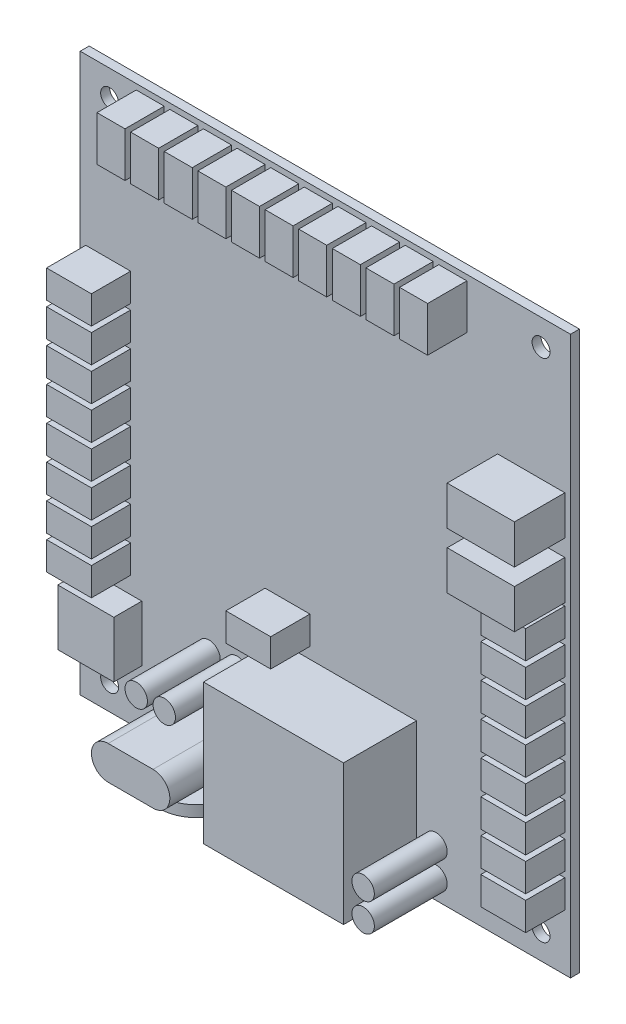
from build123d import *

# Parameters (mm, degrees)
SKETCH_1_W      = 87.5
SKETCH_1_H      = 99.5
SKETCH_1_R      = 1.6
EXTRUDE_1_DEPTH = 1.6
SKETCH_2_W      = 10
SKETCH_2_H      = 10
EXTRUDE_2_DEPTH = 5
SKETCH_3_W      = 25
SKETCH_3_H      = 25
EXTRUDE_3_DEPTH = 13
SKETCH_4_W      = 5
SKETCH_4_H      = 8
SKETCH_4_W_2    = 8
SKETCH_4_H_2    = 5
EXTRUDE_4_DEPTH = 7
SKETCH_5_W      = 12
SKETCH_5_H      = 7
EXTRUDE_5_DEPTH = 9
EXTRUDE_6_DEPTH = 18
SKETCH_7_R      = 2
EXTRUDE_7_DEPTH = 13
SKETCH_8_R      = 6.5
EXTRUDE_8_DEPTH = 2


with BuildPart() as part:
    # 草图1 → 凸台-拉伸1 (new body)
    with BuildSketch(Plane.XY):
        Rectangle(SKETCH_1_W, SKETCH_1_H)
        with Locations((-38.5, 45.15)):
            Circle(SKETCH_1_R, mode=Mode.SUBTRACT)
        with Locations((38.5, 45.15)):
            Circle(SKETCH_1_R, mode=Mode.SUBTRACT)
        with Locations((-38.5, -45.15)):
            Circle(SKETCH_1_R, mode=Mode.SUBTRACT)
        with Locations((38.5, -45.15)):
            Circle(SKETCH_1_R, mode=Mode.SUBTRACT)
    extrude(amount=EXTRUDE_1_DEPTH)

    # 草图2 → 凸台-拉伸2 (add)
    with BuildSketch(Plane.XY.offset(1.6)):
        with Locations((-37.75, -34.75)):
            Rectangle(SKETCH_2_W, SKETCH_2_H)
    extrude(amount=EXTRUDE_2_DEPTH)

    # 草图3 → 凸台-拉伸3 (add)
    with BuildSketch(Plane.XY.offset(1.6)):
        with Locations((3.75, -36.25)):
            Rectangle(SKETCH_3_W, SKETCH_3_H)
    extrude(amount=EXTRUDE_3_DEPTH)

    # 草图4 → 凸台-拉伸4 (add)
    with BuildSketch(Plane.XY.offset(1.6)):
        with Locations((-31.25, 44.75)):
            Rectangle(SKETCH_4_W, SKETCH_4_H)
        with Locations((-25.25, 44.75)):
            Rectangle(SKETCH_4_W, SKETCH_4_H)
        with Locations((-19.25, 44.75)):
            Rectangle(SKETCH_4_W, SKETCH_4_H)
        with Locations((-13.25, 44.75)):
            Rectangle(SKETCH_4_W, SKETCH_4_H)
        with Locations((-7.25, 44.75)):
            Rectangle(SKETCH_4_W, SKETCH_4_H)
        with Locations((-1.25, 44.75)):
            Rectangle(SKETCH_4_W, SKETCH_4_H)
        with Locations((4.75, 44.75)):
            Rectangle(SKETCH_4_W, SKETCH_4_H)
        with Locations((10.75, 44.75)):
            Rectangle(SKETCH_4_W, SKETCH_4_H)
        with Locations((16.75, 44.75)):
            Rectangle(SKETCH_4_W, SKETCH_4_H)
        with Locations((22.75, 44.75)):
            Rectangle(SKETCH_4_W, SKETCH_4_H)
        with Locations((-38.75, -24.25)):
            Rectangle(SKETCH_4_W_2, SKETCH_4_H_2)
        with Locations((-38.75, -18.25)):
            Rectangle(SKETCH_4_W_2, SKETCH_4_H_2)
        with Locations((-38.75, -12.25)):
            Rectangle(SKETCH_4_W_2, SKETCH_4_H_2)
        with Locations((-38.75, -6.25)):
            Rectangle(SKETCH_4_W_2, SKETCH_4_H_2)
        with Locations((-38.75, -0.25)):
            Rectangle(SKETCH_4_W_2, SKETCH_4_H_2)
        with Locations((-38.75, 5.75)):
            Rectangle(SKETCH_4_W_2, SKETCH_4_H_2)
        with Locations((-38.75, 11.75)):
            Rectangle(SKETCH_4_W_2, SKETCH_4_H_2)
        with Locations((-38.75, 17.75)):
            Rectangle(SKETCH_4_W_2, SKETCH_4_H_2)
        with Locations((38.75, -37.25)):
            Rectangle(SKETCH_4_W_2, SKETCH_4_H_2)
        with Locations((38.75, -31.25)):
            Rectangle(SKETCH_4_W_2, SKETCH_4_H_2)
        with Locations((38.75, -25.25)):
            Rectangle(SKETCH_4_W_2, SKETCH_4_H_2)
        with Locations((38.75, -19.25)):
            Rectangle(SKETCH_4_W_2, SKETCH_4_H_2)
        with Locations((38.75, -13.25)):
            Rectangle(SKETCH_4_W_2, SKETCH_4_H_2)
        with Locations((38.75, -7.25)):
            Rectangle(SKETCH_4_W_2, SKETCH_4_H_2)
        with Locations((38.75, -1.25)):
            Rectangle(SKETCH_4_W_2, SKETCH_4_H_2)
        with Locations((38.75, 4.75)):
            Rectangle(SKETCH_4_W_2, SKETCH_4_H_2)
        with Locations((-6.75, -19.25)):
            Rectangle(SKETCH_4_W_2, SKETCH_4_H_2)
    extrude(amount=EXTRUDE_4_DEPTH)

    # 草图5 → 凸台-拉伸5 (add)
    with BuildSketch(Plane.XY.offset(1.6)):
        with Locations((36.75, 11.25)):
            Rectangle(SKETCH_5_W, SKETCH_5_H)
        with Locations((36.75, 21.25)):
            Rectangle(SKETCH_5_W, SKETCH_5_H)
    extrude(amount=EXTRUDE_5_DEPTH)

    # 草图6 → 凸台-拉伸6 (add)
    with BuildSketch(Plane.XY.offset(1.6)):
        with BuildLine():
            Line((-20.75, -36.75), (-12.75, -36.75))
            ThreePointArc((-12.75, -36.75), (-9.75, -39.75), (-12.75, -42.75))
            Line((-12.75, -42.75), (-20.75, -42.75))
            ThreePointArc((-20.75, -42.75), (-23.75, -39.75), (-20.75, -36.75))
        make_face()
    extrude(amount=EXTRUDE_6_DEPTH)

    # 草图7 → 凸台-拉伸7 (add)
    with BuildSketch(Plane.XY.offset(1.6)):
        with Locations(Location((-20.75, -31.75, 0), (0, 0, 180))):
            Circle(SKETCH_7_R)
        with Locations(Location((-15.75, -31.75, 0), (0, 0, 180))):
            Circle(SKETCH_7_R)
        with Locations(Location((19.75, -41.25, 0), (0, 0, 180))):
            Circle(SKETCH_7_R)
        with Locations(Location((19.75, -46.25, 0), (0, 0, 180))):
            Circle(SKETCH_7_R)
    extrude(amount=EXTRUDE_7_DEPTH)

    # 草图8 → 凸台-拉伸8 (add)
    with BuildSketch(Plane(origin=(0, -47.75, 0), x_dir=(-1, 0, 0), z_dir=(0, -1, 0))):
        with Locations((17, -7.6)):
            Circle(SKETCH_8_R)
    extrude(amount=-EXTRUDE_8_DEPTH)


solid = part.part
